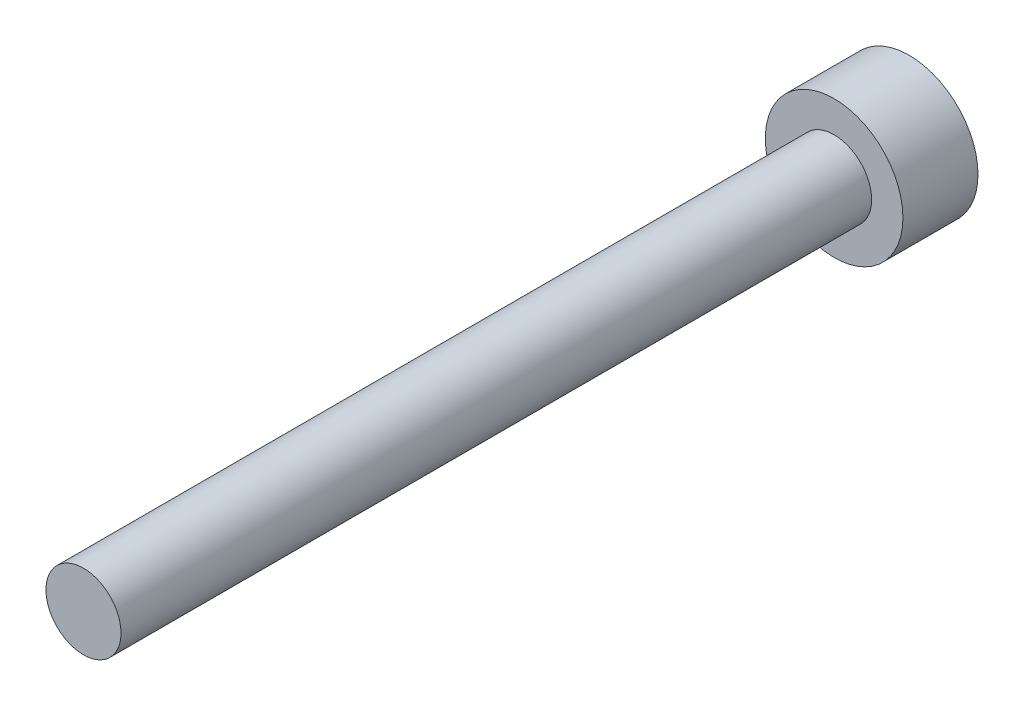
from build123d import *

# Parameters (mm, degrees)
F_01_START                = -3
S01_HEAD_R                = 2.75
F_01_HEAD_DEPTH           = 3
S02_NOMINAL_SHANK_R       = 1.5
F_02_NOMINAL_SHANK_DEPTH  = 30
F_03_START                = -3.1
F_03_HEX_KEY_SOCKET_DEPTH = 1.75


with BuildPart() as part:
    # S01 - Head → 01 - Head (new body)
    with BuildSketch(Plane.XY.offset(F_01_START)):
        Circle(S01_HEAD_R)
    extrude(amount=F_01_HEAD_DEPTH)

    # S02 - Nominal shank → 02 - Nominal shank (add)
    with BuildSketch(Plane.XY):
        Circle(S02_NOMINAL_SHANK_R)
    extrude(amount=F_02_NOMINAL_SHANK_DEPTH)

    # S03 - Hex key socket → 03 - Hex key socket (cut)
    with BuildSketch(Plane.XY.offset(F_03_START)):
        Polygon((1.443375673, 0), (0.721687836, 1.25), (-0.721687836, 1.25), (-1.443375673, 0), (-0.721687836, -1.25), (0.721687836, -1.25), align=None)
    extrude(amount=F_03_HEX_KEY_SOCKET_DEPTH, mode=Mode.SUBTRACT)


solid = part.part
